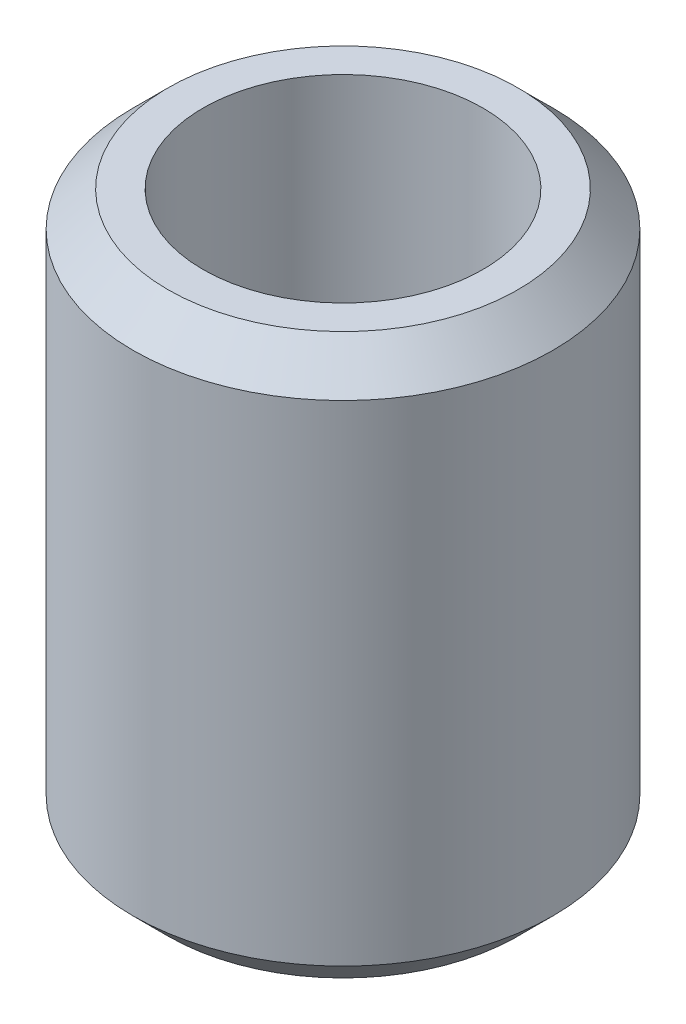
from build123d import *


with BuildPart() as part:
    # Sketch1 → Revolve1 (revolve)
    with BuildSketch(Plane(origin=(0, 0, 0), x_dir=(0, 0, -1), z_dir=(1, 0, 0))):
        Polygon((-2, 4), (-2.5, 4), (-3, 3.5), (-3, -3.5), (-2.5, -4), (-2, -4), align=None)
    revolve(axis=Axis((0, 7.078787879, 0), (0, -1, 0)))


solid = part.part
